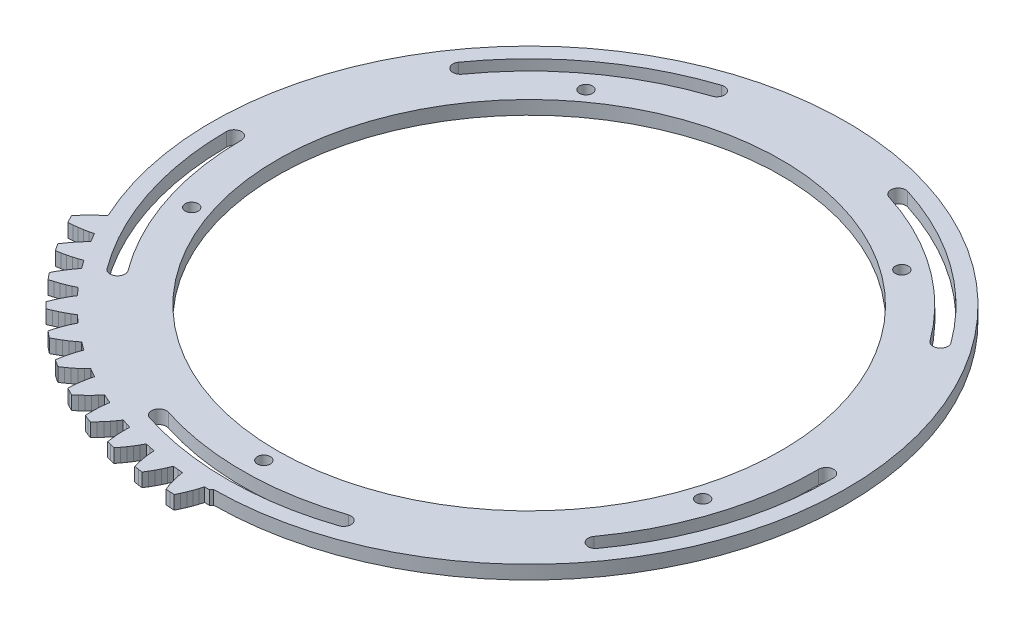
from build123d import *

# Parameters (mm, degrees)
SKETCH1_R           = 139.7
SKETCH1_R_2         = 110.900692199
SKETCH1_R_3         = 2.858519502
BOSS_EXTRUDE1_DEPTH = 6
BOSS_EXTRUDE2_DEPTH = 6


with BuildPart() as part:
    # Sketch1 → Boss-Extrude1 (new body)
    with BuildSketch(Plane(origin=(0, 0, 0), x_dir=(1, 0, 0), z_dir=(0, 1, 0))):
        with Locations(Location((0, 0, 0), (0, 0, 270))):
            Circle(SKETCH1_R)
        with Locations(Location((0, 0, 0), (0, 0, 270))):
            Circle(SKETCH1_R_2, mode=Mode.SUBTRACT)
        with Locations(Location((-111.545434605, -37.009115707, 0), (0, 0, 270))):
            Circle(SKETCH1_R_3, mode=Mode.SUBTRACT)
        with Locations(Location((-69.667195594, 94.649566743, 0), (0, 0, 270))):
            Circle(SKETCH1_R_3, mode=Mode.SUBTRACT)
        with Locations(Location((68.488739827, 95.505764975, 0), (0, 0, 270))):
            Circle(SKETCH1_R_3, mode=Mode.SUBTRACT)
        with Locations(Location((111.995564653, -35.623757867, 0), (0, 0, 270))):
            Circle(SKETCH1_R_3, mode=Mode.SUBTRACT)
        with Locations(Location((0.728325718, -117.522458144, 0), (0, 0, 270))):
            Circle(SKETCH1_R_3, mode=Mode.SUBTRACT)
        with BuildLine():
            ThreePointArc((-132.839270462, -0.440253395), (-126.081527089, -41.831974936), (-106.756391377, -79.054022668))
            ThreePointArc((-106.756391377, -79.054022668), (-102.14050485, -79.74220256), (-101.452324959, -75.126316032))
            ThreePointArc((-101.452324959, -75.126316032), (-119.817313909, -39.753602197), (-126.239306709, -0.41837992))
            ThreePointArc((-126.239306709, -0.41837992), (-129.550225323, 2.87066522), (-132.839270462, -0.440253395))
        make_face(mode=Mode.SUBTRACT)
        with BuildLine():
            ThreePointArc((-41.468297953, 126.201608012), (-78.745906899, 106.983866759), (-108.174382592, 77.102325197))
            ThreePointArc((-108.174382592, 77.102325197), (-107.402493181, 72.499696955), (-102.799864938, 73.271586367))
            ThreePointArc((-102.799864938, 73.271586367), (-74.833508634, 101.668498491), (-39.40799408, 119.931428752))
            ThreePointArc((-39.40799408, 119.931428752), (-37.303056386, 124.096670319), (-41.468297953, 126.201608012))
        make_face(mode=Mode.SUBTRACT)
        with BuildLine():
            ThreePointArc((107.210452872, 78.437136581), (77.41388015, 107.95164084), (39.900946224, 126.705880252))
            ThreePointArc((39.900946224, 126.705880252), (35.762113588, 124.549479452), (37.918514388, 120.410646816))
            ThreePointArc((37.918514388, 120.410646816), (73.567662076, 102.58818985), (101.883826939, 74.540079208))
            ThreePointArc((101.883826939, 74.540079208), (106.495668592, 73.825294928), (107.210452872, 78.437136581))
        make_face(mode=Mode.SUBTRACT)
        with BuildLine():
            ThreePointArc((107.728001777, -77.724791625), (126.590316033, -40.266083578), (132.834523541, 1.206215373))
            ThreePointArc((132.834523541, 1.206215373), (129.504694887, 4.476114627), (126.234795633, 1.146285973))
            ThreePointArc((126.234795633, 1.146285973), (120.30082427, -38.26551032), (102.375662032, -73.863126278))
            ThreePointArc((102.375662032, -73.863126278), (103.120999231, -78.470128824), (107.728001777, -77.724791625))
        make_face(mode=Mode.SUBTRACT)
        with BuildLine():
            ThreePointArc((-40.630886234, -126.473699574), (0.823237805, -132.837449085), (42.195304204, -125.960398154))
            ThreePointArc((42.195304204, -125.960398154), (44.276189555, -121.783088475), (40.098879876, -119.702203124))
            ThreePointArc((40.098879876, -119.702203124), (0.782336198, -126.237575825), (-38.612188182, -120.190001763))
            ThreePointArc((-38.612188182, -120.190001763), (-42.763386113, -122.322501643), (-40.630886234, -126.473699574))
        make_face(mode=Mode.SUBTRACT)
    extrude(amount=BOSS_EXTRUDE1_DEPTH)

    # Sketch3 → Boss-Extrude2 (add)
    with BuildSketch(Plane(origin=(0, 0, 0), x_dir=(1, 0, 0), z_dir=(0, 1, 0))):
        Polygon((-95.773753062, -103.045246756), (-97.479742217, -104.107410944), (-99.261106126, -105.095838036), (-101.108863827, -106.01739192), (-103.016809042, -106.876283414), (-104.980371742, -107.675286499), (-106.33636991, -106.336370617), (-107.675286499, -104.980371742), (-106.876283414, -103.016809042), (-106.01739192, -101.108863827), (-105.095838036, -99.261106126), (-104.107410944, -97.479742217), (-103.045246049, -95.773753769), (-104.545807248, -94.133459784), (-106.020245802, -92.469677833), (-107.827911256, -93.347707173), (-109.702848727, -94.144494893), (-111.636816886, -94.867845331), (-113.624087461, -95.522605704), (-115.660410741, -96.111989106), (-116.869033714, -94.638669195), (-118.058856839, -93.150141538), (-117.058976031, -91.280851729), (-116.005372077, -89.473145264), (-114.895732033, -87.731853803), (-113.726522485, -86.063541419), (-112.491817172, -84.477928708), (-113.812713145, -82.689779402), (-115.105171405, -80.880976214), (-116.994717702, -81.565251932), (-118.942673847, -82.161700744), (-120.941639262, -82.678923899), (-122.986483886, -83.122368239), (-125.073255699, -83.495667586), (-126.121231082, -81.904086895), (-127.148952099, -80.299355431), (-125.959167865, -78.544812082), (-124.722367394, -76.857123558), (-123.436794233, -75.241355571), (-122.09961359, -73.704414434), (-120.705937944, -72.25653764), (-121.832660274, -70.340111385), (-122.928969942, -68.406123427), (-124.879681682, -68.889141705), (-126.879345011, -69.278704509), (-128.921415655, -69.584153425), (-131.001382273, -69.811433808), (-133.115753878, -69.964557074), (-133.991627956, -68.272158512), (-134.845989017, -66.568782824), (-133.479314244, -64.948225603), (-132.072885927, -63.399072025), (-130.625448246, -61.926529225), (-129.134925841, -60.537782113), (-127.597545591, -59.243508003), (-126.106880528, -57.335748917), (-97.479742217, -91.280851729), (-36.746370479, -131.800185954), (2.981729238, -137.126675673), (-3.54e-07, -140.680262722), (-2.22305215, -140.662681219), (-2.780107336, -142.593555786), (-3.442531333, -144.520080232), (-4.199047908, -146.441316227), (-5.042214761, -148.356246243), (-5.966801426, -150.263912152), (-7.87039652, -150.176245053), (-9.772733672, -150.064450764), (-10.49287031, -148.070594196), (-10.556398527, -148.151897861), (-11.682774045, -144.088229615), (-12.140228999, -142.103013892), (-12.492374539, -140.12448457), (-14.705089849, -139.909576435), (-16.914112646, -139.659725911), (-17.669951106, -141.521811716), (-18.530140141, -143.36855189), (-19.483324325, -145.200164928), (-20.522040145, -147.016491732), (-21.640960258, -148.817033084), (-23.524978394, -148.530862727), (-25.405224116, -148.22084378), (-25.912948705, -146.16264898), (-26.339570268, -144.11423276), (-26.68010158, -142.077710076), (-26.927518243, -140.055555801), (-27.070942833, -138.051062933), (-29.249073549, -137.606041038), (-31.419880761, -137.126675673), (-32.366200352, -138.899538038), (-33.414735056, -140.646217652), (-34.554149953, -142.368190956), (-35.777021128, -144.065979086), (-37.07802053, -145.739718515), (-38.921807119, -145.258177383), (-40.759347127, -144.753307383), (-41.04916969, -142.653304188), (-41.25932819, -140.571541519), (-41.385111172, -138.510572739), (-41.419815266, -136.473630741), (-41.352922257, -134.465127163), (-43.472602113, -133.794860645), (-45.581385453, -133.091187574), (-46.707868781, -134.755448237), (-47.933214829, -136.382949953), (-49.246387783, -137.976387507), (-50.640043629, -139.53703652), (-52.108854321, -141.065634504), (-53.892212978, -140.393991956), (-55.666891193, -139.699818158), (-55.735620558, -137.581036328), (-55.727019311, -135.488696048), (-55.636697733, -133.42587182), (-55.458270651, -131.396473944), (-55.181818769, -129.40594997), (-57.219798093, -128.51780264), (-59.243508003, -127.597545591), (-60.537782113, -129.134925841), (-61.926529225, -130.625448246), (-63.399071318, -132.072886634), (-64.948225603, -133.479314244), (-66.568782824, -134.845989017), (-68.272158512, -133.991627956), (-69.964557074, -133.115753878), (-69.811433808, -131.001382273), (-69.584153425, -128.921415655), (-69.278704509, -126.879345011), (-68.889141705, -124.879681682), (-68.406123427, -122.928969942), (-70.340111385, -121.832660274), (-72.25653764, -120.705937944), (-73.704414434, -122.09961359), (-75.241355571, -123.436794233), (-76.857123557, -124.722367394), (-78.544812082, -125.959167865), (-80.299355431, -127.148952099), (-81.904086895, -126.121231082), (-83.495667586, -125.073255699), (-83.122368239, -122.986483886), (-82.678923192, -120.941639969), (-82.161700037, -118.942674555), (-81.565251932, -116.994717702), (-80.880976214, -115.105171405), (-82.689779402, -113.812713145), (-84.477928708, -112.491817172), (-86.063541419, -113.726522485), (-87.731853803, -114.895732033), (-89.473145264, -116.005372077), (-91.280851729, -117.058976031), (-93.150140831, -118.058857546), (-94.638669195, -116.869033714), (-96.111989106, -115.660410741), (-95.522605704, -113.624087461), (-94.867845331, -111.636816886), (-94.144494893, -109.702848727), (-93.347707173, -107.827911256), (-92.469677833, -106.020245802), (-94.133459784, -104.545807248), align=None)
    extrude(amount=BOSS_EXTRUDE2_DEPTH)


solid = part.part
